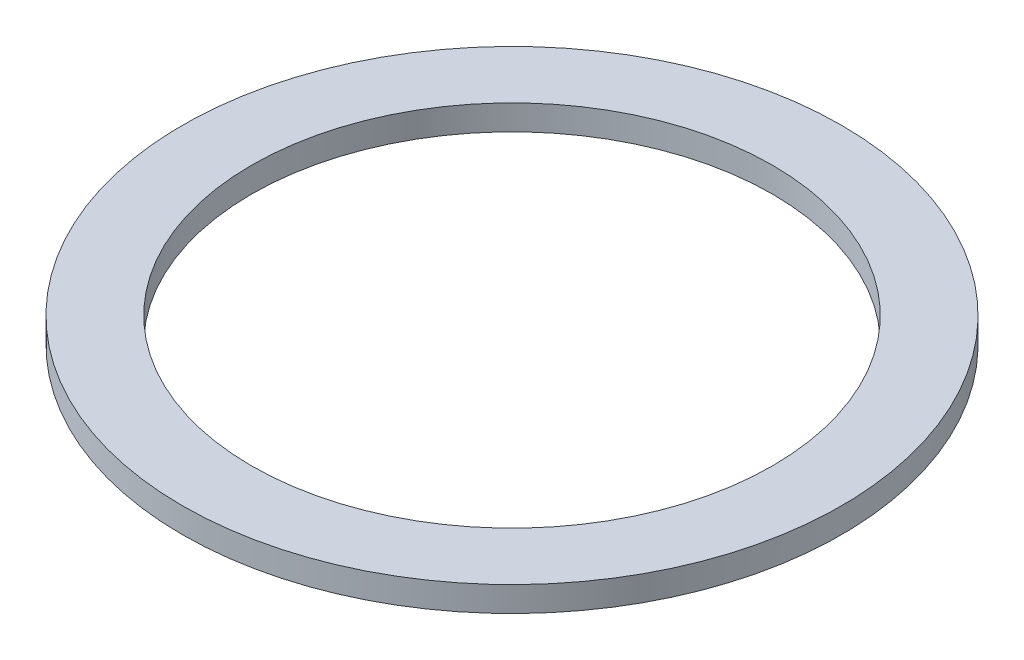
from build123d import *

# Parameters (mm, degrees)
SKETCH1_R           = 13.35
SKETCH1_R_2         = 10.55
BOSS_EXTRUDE1_DEPTH = 1.016


with BuildPart() as part:
    # Sketch1 → Boss-Extrude1 (new body)
    with BuildSketch(Plane(origin=(0, 0, 0), x_dir=(1, 0, 0), z_dir=(0, 1, 0))):
        with Locations(Location((0, 0, 0), (0, 0, 270))):
            Circle(SKETCH1_R)
        with Locations(Location((0, 0, 0), (0, 0, 270))):
            Circle(SKETCH1_R_2, mode=Mode.SUBTRACT)
    extrude(amount=BOSS_EXTRUDE1_DEPTH)


solid = part.part
